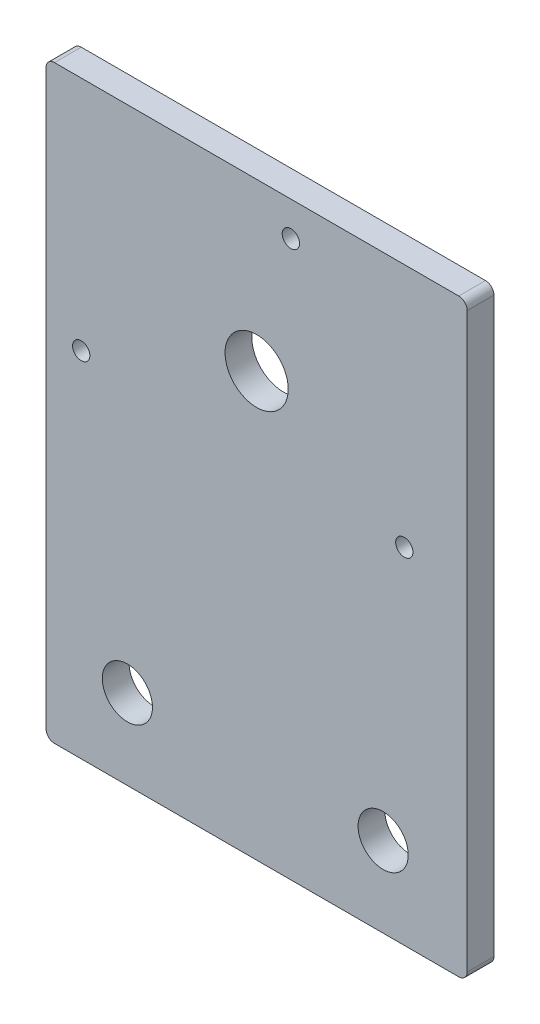
from build123d import *

# Parameters (mm, degrees)
SKETCH1_W           = 100
SKETCH1_H           = 140
SKETCH1_R           = 5.953762401
SKETCH1_R_2         = 2.054847291
SKETCH1_R_3         = 7.5
BOSS_EXTRUDE1_DEPTH = 6.35
FILLET1_R           = 2


with BuildPart() as part:
    # Sketch1 → Boss-Extrude1 (new body)
    with BuildSketch(Plane.XY):
        Rectangle(SKETCH1_W, SKETCH1_H)
        with Locations((-30.691299308, -50.95)):
            Circle(SKETCH1_R, mode=Mode.SUBTRACT)
        with Locations((30.040853965, -50.95)):
            Circle(SKETCH1_R, mode=Mode.SUBTRACT)
        with Locations((-41.650484861, 13.92267898)):
            Circle(SKETCH1_R_2, mode=Mode.SUBTRACT)
        with Locations((8.122482859, 61.869115774)):
            Circle(SKETCH1_R_2, mode=Mode.SUBTRACT)
        with Locations((35.06381401, 11.867831689)):
            Circle(SKETCH1_R_2, mode=Mode.SUBTRACT)
        with Locations((0, 30.582009883)):
            Circle(SKETCH1_R_3, mode=Mode.SUBTRACT)
    extrude(amount=BOSS_EXTRUDE1_DEPTH)

    # Fillet1
    fillet1_edges = [part.edges().sort_by_distance(p)[0] for p in [
        (50, -70, 3.175),
        (-50, -70, 3.175),
        (-50, 70, 3.175),
        (50, 70, 3.175),
    ]]
    fillet(fillet1_edges, radius=FILLET1_R)


solid = part.part
